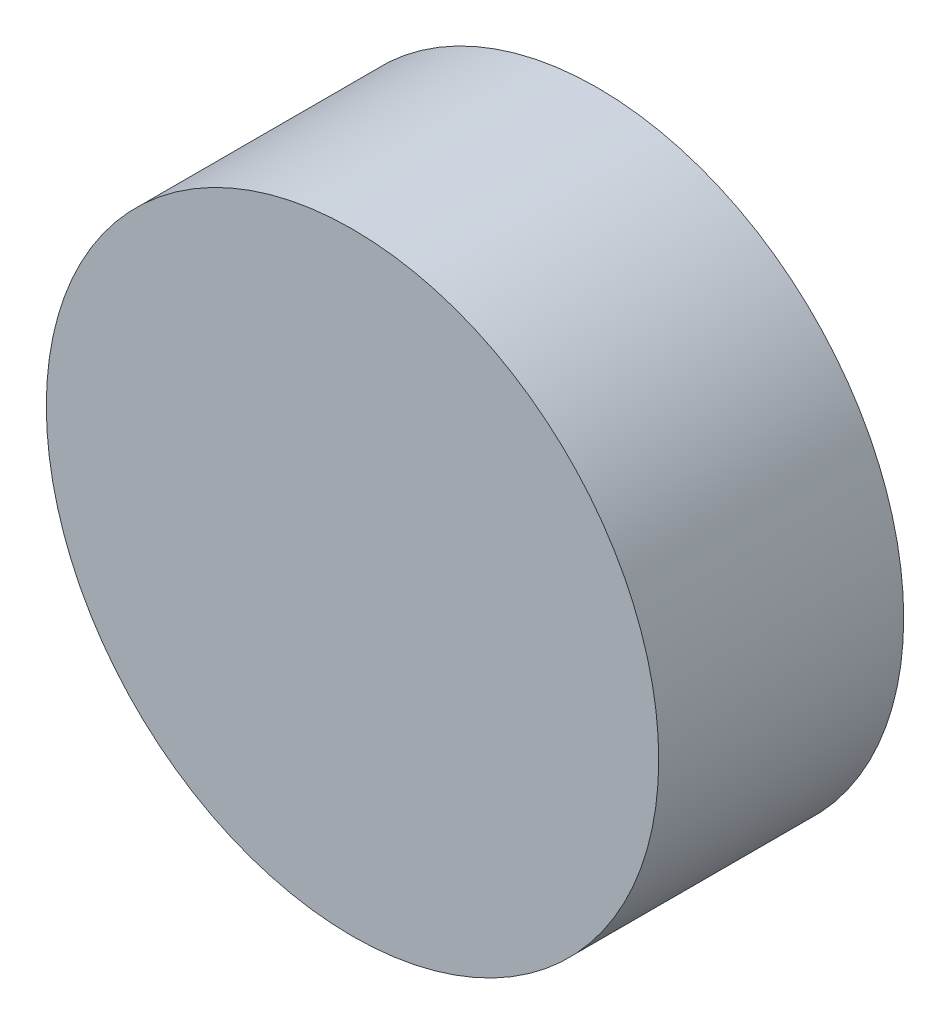
from build123d import *

# Parameters (mm, degrees)
KAP_HELEZON_TOPUZ_D50_START = -700
SKETCH1_R                   = 25
KAP_HELEZON_TOPUZ_D50_DEPTH = 20


with BuildPart() as part:
    # Sketch1 → KAP_helezon_topuz_D50 (new body)
    with BuildSketch(Plane.XY.offset(KAP_HELEZON_TOPUZ_D50_START)):
        with Locations((0, 68)):
            Circle(SKETCH1_R)
    extrude(amount=-KAP_HELEZON_TOPUZ_D50_DEPTH)


solid = part.part
